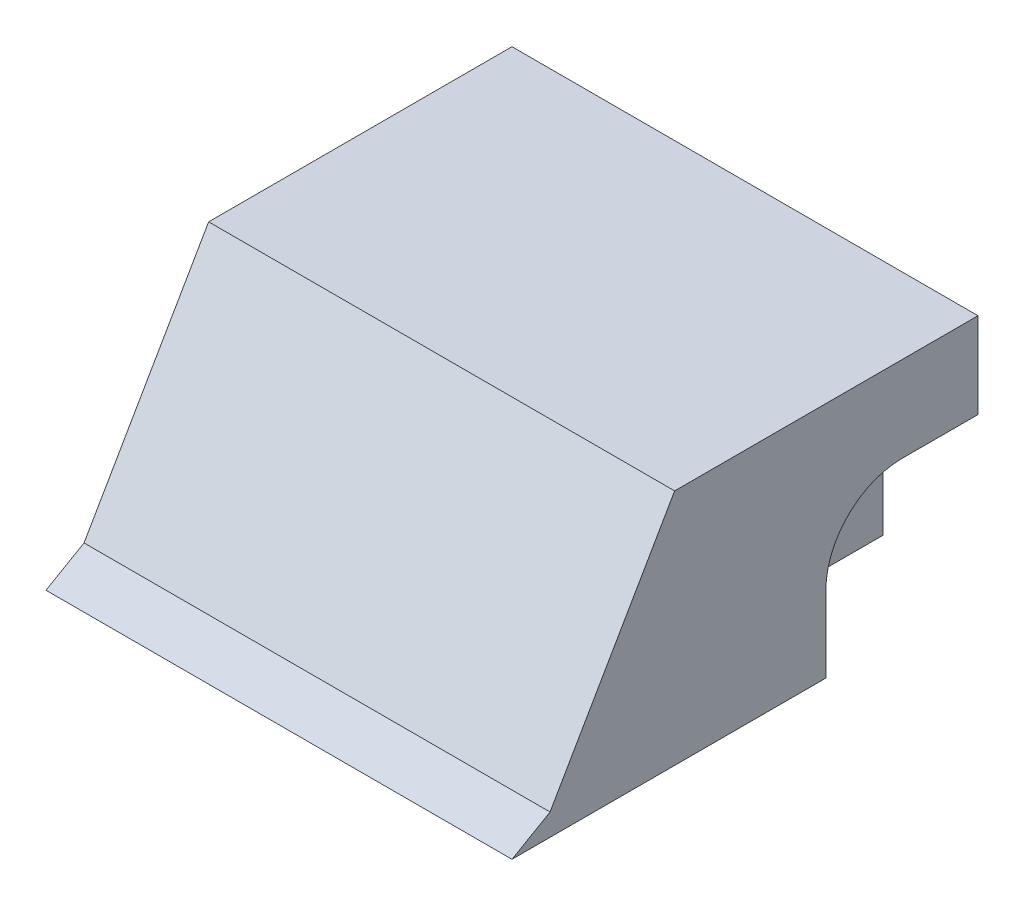
from build123d import *

# Parameters (mm, degrees)
ESBO_O1_W                  = 98
ESBO_O1_H                  = 98
RESSALTO_EXTRUS_O1_DEPTH   = 25
CORTE_EXTRUS_O4_DEPTH      = 74.668174947
CORTE_EXTRUS_O4_DEPTH_BACK = 74.668174947
CORTE_EXTRUS_O10_START     = 49
CORTE_EXTRUS_O10_DEPTH     = 20
CORTE_EXTRUS_O11_START     = -29
CORTE_EXTRUS_O11_DEPTH     = 20


with BuildPart() as part:
    # Esboço1 → Ressalto-extrusão1 (new, symmetric)
    with BuildSketch(Plane(origin=(0, 0, 0), x_dir=(1, 0, 0), z_dir=(0, 1, 0))):
        Rectangle(ESBO_O1_W, ESBO_O1_H)
    extrude(amount=RESSALTO_EXTRUS_O1_DEPTH, both=True)

    # Esboço2 → Corte-extrusão4 (cut, two sides: drawn at the far end of the back side and taken through both)
    with BuildSketch(Plane(origin=(0, 0, 0), x_dir=(0, 0, -1), z_dir=(1, 0, 0)).offset(-CORTE_EXTRUS_O4_DEPTH_BACK)):
        Polygon((-49, 25), (-49, -25), (-41, -20.381197846), (-14.799153207, 25), align=None)
    extrude(amount=CORTE_EXTRUS_O4_DEPTH + CORTE_EXTRUS_O4_DEPTH_BACK, mode=Mode.SUBTRACT)

    # Esboço7 → Corte-extrusão10 (cut)
    with BuildSketch(Plane(origin=(0, 0, 0), x_dir=(0, 0, -1), z_dir=(1, 0, 0)).offset(CORTE_EXTRUS_O10_START)):
        with BuildLine():
            ThreePointArc((33, -25), (44.313708499, -20.313708499), (49, -9))
            Line((49, -9), (33, -9))
            Line((33, -9), (33, -25))
        make_face()
        with BuildLine():
            ThreePointArc((33, 7), (44.313708499, 2.313708499), (49, -9))
            Line((49, -9), (49, 7))
            Line((49, 7), (33, 7))
        make_face()
        with BuildLine():
            Line((33, -9), (49, -9))
            ThreePointArc((49, -9), (44.313708499, 2.313708499), (33, 7))
            Line((33, 7), (33, -9))
        make_face()
        with BuildLine():
            Line((49, -25), (49, -9))
            ThreePointArc((49, -9), (44.313708499, -20.313708499), (33, -25))
            Line((33, -25), (49, -25))
        make_face()
        with BuildLine():
            Line((33, -25), (33, -9))
            Line((33, -9), (17, -9))
            ThreePointArc((17, -9), (21.686291501, -20.313708499), (33, -25))
        make_face()
        with BuildLine():
            Line((17, -9), (33, -9))
            Line((33, -9), (33, 7))
            ThreePointArc((33, 7), (21.686291501, 2.313708499), (17, -9))
        make_face()
        with BuildLine():
            Line((17, -25), (33, -25))
            ThreePointArc((33, -25), (21.686291501, -20.313708499), (17, -9))
            Line((17, -9), (17, -25))
        make_face()
    extrude(amount=-CORTE_EXTRUS_O10_DEPTH, mode=Mode.SUBTRACT)

    # Esboço9 → Corte-extrusão11 (cut)
    with BuildSketch(Plane(origin=(0, 0, 0), x_dir=(0, 0, -1), z_dir=(1, 0, 0)).offset(CORTE_EXTRUS_O11_START)):
        with BuildLine():
            Line((33, -25), (49, -25))
            Line((49, -25), (49, -9))
            ThreePointArc((49, -9), (44.313708499, -20.313708499), (33, -25))
        make_face()
        with BuildLine():
            ThreePointArc((17, -9), (21.686291501, -20.313708499), (33, -25))
            Line((33, -25), (33, -9))
            Line((33, -9), (17, -9))
        make_face()
        with BuildLine():
            Line((17, -25), (33, -25))
            ThreePointArc((33, -25), (21.686291501, -20.313708499), (17, -9))
            Line((17, -9), (17, -25))
        make_face()
        with BuildLine():
            Line((33, -9), (33, -25))
            ThreePointArc((33, -25), (44.313708499, -20.313708499), (49, -9))
            Line((49, -9), (33, -9))
        make_face()
        with BuildLine():
            ThreePointArc((33, 7), (44.313708499, 2.313708499), (49, -9))
            Line((49, -9), (49, 7))
            Line((49, 7), (33, 7))
        make_face()
        with BuildLine():
            Line((33, -9), (49, -9))
            ThreePointArc((49, -9), (44.313708499, 2.313708499), (33, 7))
            Line((33, 7), (33, -9))
        make_face()
        with BuildLine():
            Line((17, -9), (33, -9))
            Line((33, -9), (33, 7))
            ThreePointArc((33, 7), (21.686291501, 2.313708499), (17, -9))
        make_face()
    extrude(amount=-CORTE_EXTRUS_O11_DEPTH, mode=Mode.SUBTRACT)


solid = part.part
